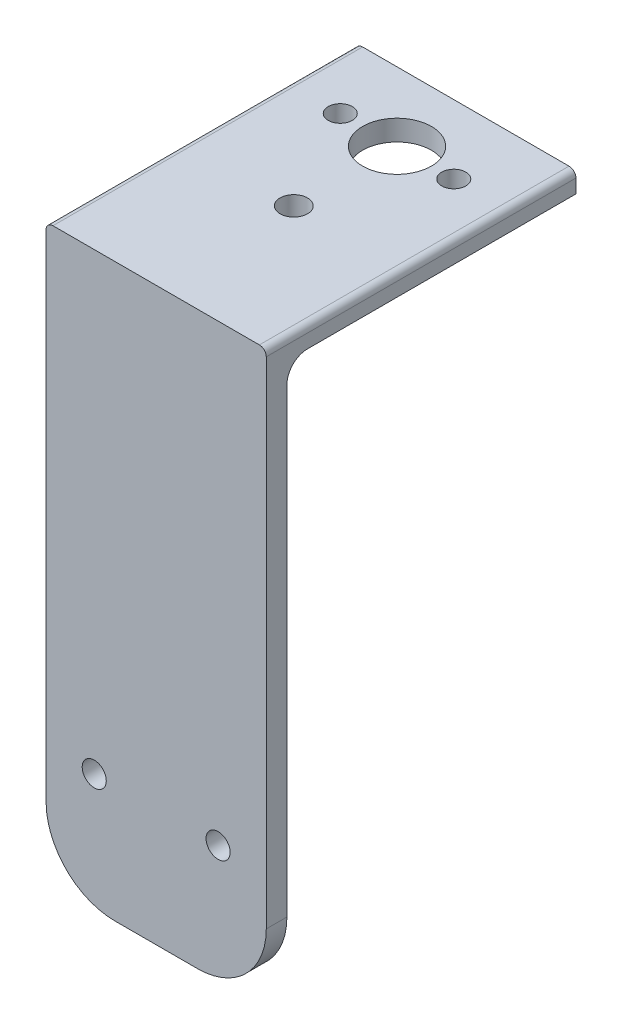
from build123d import *

# Parameters (mm, degrees)
CROQUIS1_W              = 32
CROQUIS1_H              = 45
CROQUIS1_R              = 5
SALIENTE_EXTRUIR1_DEPTH = 3
CROQUIS2_W              = 32
CROQUIS2_H              = 3
SALIENTE_EXTRUIR2_DEPTH = 80
REDONDEO1_R             = 3
REDONDEO3_R             = 1
CROQUIS5_R              = 1.75
CORTAR_EXTRUIR2_DEPTH   = 10
CROQUIS6_R              = 1.75
CORTAR_EXTRUIR3_DEPTH   = 10
REDONDEO4_R             = 10
CROQUIS7_R              = 2
CORTAR_EXTRUIR4_DEPTH   = 10


with BuildPart() as part:
    # Croquis1 → Saliente-Extruir1 (new body)
    with BuildSketch(Plane(origin=(0, 0, 0), x_dir=(1, 0, 0), z_dir=(0, 1, 0))):
        Rectangle(CROQUIS1_W, CROQUIS1_H)
        with Locations(Location((0, 12.5, 0), (0, 0, 270))):
            Circle(CROQUIS1_R, mode=Mode.SUBTRACT)
    extrude(amount=SALIENTE_EXTRUIR1_DEPTH)

    # Croquis2 → Saliente-Extruir2 (add)
    with BuildSketch(Plane.XZ):
        with Locations((0, 21)):
            Rectangle(CROQUIS2_W, CROQUIS2_H)
    extrude(amount=SALIENTE_EXTRUIR2_DEPTH)

    # Redondeo1
    redondeo1_edges = [part.edges().sort_by_distance(p)[0] for p in [
        (0, 0, 19.5),
    ]]
    fillet(redondeo1_edges, radius=REDONDEO1_R)

    # Redondeo3
    redondeo3_edges = [part.edges().sort_by_distance(p)[0] for p in [
        (-16, 3, 0),
        (16, 3, 0),
    ]]
    fillet(redondeo3_edges, radius=REDONDEO3_R)

    # Croquis5 → Cortar-Extruir2 (cut)
    with BuildSketch(Plane(origin=(0, 3, 0), x_dir=(1, 0, 0), z_dir=(0, 1, 0))):
        with Locations(Location((-8.25, 12.5, 0), (0, 0, 270))):
            Circle(CROQUIS5_R)
        with Locations(Location((8.25, 12.5, 0), (0, 0, 270))):
            Circle(CROQUIS5_R)
    extrude(amount=-CORTAR_EXTRUIR2_DEPTH, mode=Mode.SUBTRACT)

    # Croquis6 → Cortar-Extruir3 (cut)
    with BuildSketch(Plane.XY.offset(22.5)):
        with Locations((-9, -63)):
            Circle(CROQUIS6_R)
        with Locations((9, -63)):
            Circle(CROQUIS6_R)
    extrude(amount=-CORTAR_EXTRUIR3_DEPTH, mode=Mode.SUBTRACT)

    # Redondeo4
    redondeo4_edges = [part.edges().sort_by_distance(p)[0] for p in [
        (-16, -80, 21),
        (16, -80, 21),
    ]]
    fillet(redondeo4_edges, radius=REDONDEO4_R)

    # Croquis7 → Cortar-Extruir4 (cut)
    with BuildSketch(Plane(origin=(0, 3, 0), x_dir=(1, 0, 0), z_dir=(0, 1, 0))):
        with Locations(Location((0, -2.5, 0), (0, 0, 270))):
            Circle(CROQUIS7_R)
    extrude(amount=-CORTAR_EXTRUIR4_DEPTH, mode=Mode.SUBTRACT)


solid = part.part
